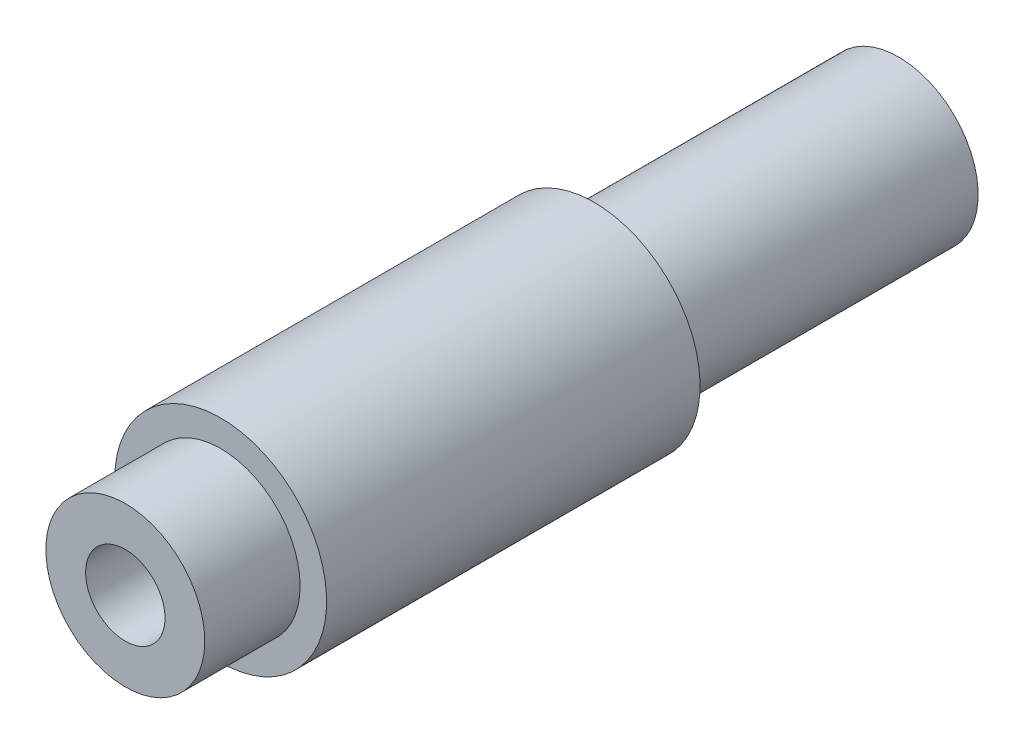
from build123d import *

# Parameters (mm, degrees)
SKETCH_1_R          = 4
SKETCH_1_R_2        = 1.5
EXTRUDE_3_DEPTH     = 29.2
SKETCH_3_R          = 4
SKETCH_3_R_2        = 3
CUT_EXTRUDE_1_DEPTH = 11.5
CUT_EXTRUDE_START   = -3.6
SKETCH_4_R          = 4
SKETCH_4_R_2        = 3
CUT_EXTRUDE_2_DEPTH = 3.6


with BuildPart() as part:
    # ｽｹｯﾁ1 → ﾎﾞｽ - 押し出し3 (new body)
    with BuildSketch(Plane.XY):
        with Locations(Location((0, 0, 0), (0, 0, 180))):
            Circle(SKETCH_1_R)
        with Locations(Location((0, 0, 0), (0, 0, 180))):
            Circle(SKETCH_1_R_2, mode=Mode.SUBTRACT)
    extrude(amount=EXTRUDE_3_DEPTH)

    # ｽｹｯﾁ3 → ｶｯﾄ - 押し出し1 (cut)
    with BuildSketch(Plane(origin=(0, 0, 0), x_dir=(-1, 0, 0), z_dir=(0, 0, -1))):
        Circle(SKETCH_3_R)
        Circle(SKETCH_3_R_2, mode=Mode.SUBTRACT)
    extrude(amount=-CUT_EXTRUDE_1_DEPTH, mode=Mode.SUBTRACT)

    # ｽｹｯﾁ4 → ｶｯﾄ - 押し出し2 (cut)
    with BuildSketch(Plane.XY.offset(29.2).offset(CUT_EXTRUDE_START)):
        with Locations(Location((0, 0, 0), (0, 0, 180))):
            Circle(SKETCH_4_R)
        with Locations(Location((0, 0, 0), (0, 0, 180))):
            Circle(SKETCH_4_R_2, mode=Mode.SUBTRACT)
    extrude(amount=CUT_EXTRUDE_2_DEPTH, mode=Mode.SUBTRACT)


solid = part.part
